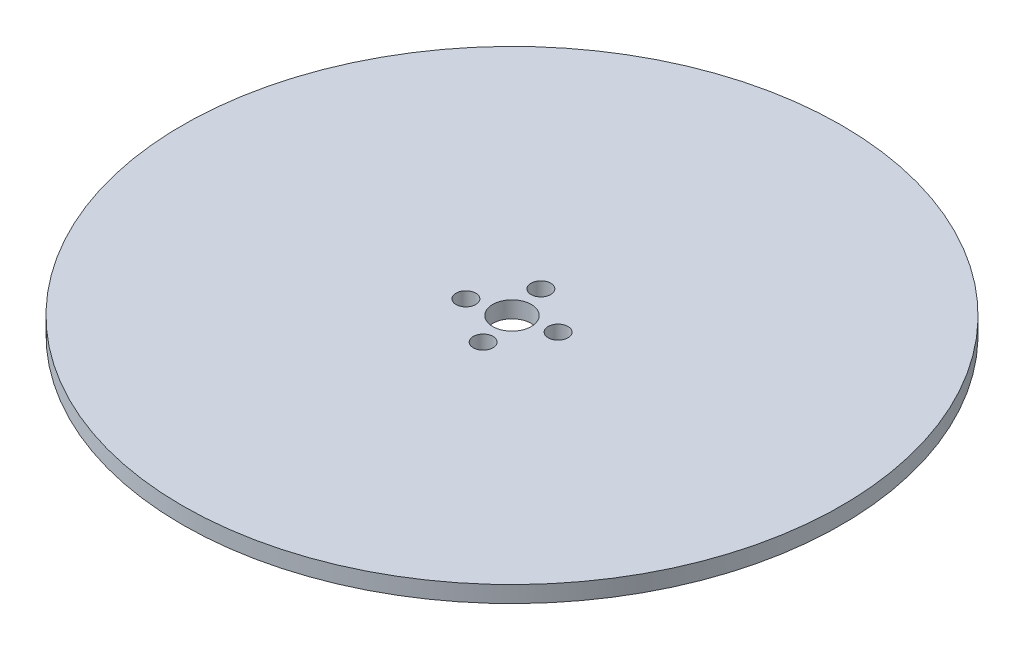
from build123d import *

# Parameters (mm, degrees)
SKETCH1_R           = 60
BOSS_EXTRUDE1_DEPTH = 3
CUT_EXTRUDE1_REACH  = 86.906
SKETCH2_R           = 3.5
SKETCH2_R_2         = 1.8
SKETCH3_R           = 54
SKETCH3_R_2         = 36
BOSS_EXTRUDE2_DEPTH = 3


with BuildPart() as part:
    # Sketch1 → Boss-Extrude1 (new body)
    with BuildSketch(Plane(origin=(0, 0, 0), x_dir=(1, 0, 0), z_dir=(0, 1, 0))):
        with Locations(Location((0, 0, 0), (0, 0, 270))):
            Circle(SKETCH1_R)
    extrude(amount=BOSS_EXTRUDE1_DEPTH)

    # Sketch2 → Cut-Extrude1 (cut, up to next)
    with BuildSketch(Plane.XZ, mode=Mode.PRIVATE) as cut_extrude1_sk1:
        with Locations(Location((0, 0, 0), (0, 0, 270))):
            Circle(SKETCH2_R)
    cut_extrude1_tool1 = extrude(cut_extrude1_sk1.sketch, amount=-CUT_EXTRUDE1_REACH, mode=Mode.PRIVATE) & part.part
    # Sketch2 → Cut-Extrude1 (cut, up to next)
    with BuildSketch(Plane.XZ, mode=Mode.PRIVATE) as cut_extrude1_sk2:
        with Locations(Location((1.56993281, 6.821679483, 0), (0, 0, 270))):
            Circle(SKETCH2_R_2)
    cut_extrude1_tool2 = extrude(cut_extrude1_sk2.sketch, amount=-CUT_EXTRUDE1_REACH, mode=Mode.PRIVATE) & part.part
    # Sketch2 → Cut-Extrude1 (cut, up to next)
    with BuildSketch(Plane.XZ, mode=Mode.PRIVATE) as cut_extrude1_sk3:
        with Locations(Location((6.821679483, -1.56993281, 0), (0, 0, 270))):
            Circle(SKETCH2_R_2)
    cut_extrude1_tool3 = extrude(cut_extrude1_sk3.sketch, amount=-CUT_EXTRUDE1_REACH, mode=Mode.PRIVATE) & part.part
    # Sketch2 → Cut-Extrude1 (cut, up to next)
    with BuildSketch(Plane.XZ, mode=Mode.PRIVATE) as cut_extrude1_sk4:
        with Locations(Location((-1.56993281, -6.821679483, 0), (0, 0, 270))):
            Circle(SKETCH2_R_2)
    cut_extrude1_tool4 = extrude(cut_extrude1_sk4.sketch, amount=-CUT_EXTRUDE1_REACH, mode=Mode.PRIVATE) & part.part
    # Sketch2 → Cut-Extrude1 (cut, up to next)
    with BuildSketch(Plane.XZ, mode=Mode.PRIVATE) as cut_extrude1_sk5:
        with Locations(Location((-6.821679483, 1.56993281, 0), (0, 0, 270))):
            Circle(SKETCH2_R_2)
    cut_extrude1_tool5 = extrude(cut_extrude1_sk5.sketch, amount=-CUT_EXTRUDE1_REACH, mode=Mode.PRIVATE) & part.part
    add(cut_extrude1_tool1.solids().sort_by_distance((0, 0, 0))[0], mode=Mode.SUBTRACT)
    add(cut_extrude1_tool2.solids().sort_by_distance((1.569933, 0, 6.821679))[0], mode=Mode.SUBTRACT)
    add(cut_extrude1_tool3.solids().sort_by_distance((6.821679, 0, -1.569933))[0], mode=Mode.SUBTRACT)
    add(cut_extrude1_tool4.solids().sort_by_distance((-1.569933, 0, -6.821679))[0], mode=Mode.SUBTRACT)
    add(cut_extrude1_tool5.solids().sort_by_distance((-6.821679, 0, 1.569933))[0], mode=Mode.SUBTRACT)

    # Sketch3 → Boss-Extrude2 (add)
    with BuildSketch(Plane.XZ):
        with Locations(Location((0, 0, 0), (0, 0, 90))):
            Circle(SKETCH3_R)
        with Locations(Location((0, 0, 0), (0, 0, 270))):
            Circle(SKETCH3_R_2, mode=Mode.SUBTRACT)
    extrude(amount=BOSS_EXTRUDE2_DEPTH)


solid = part.part
